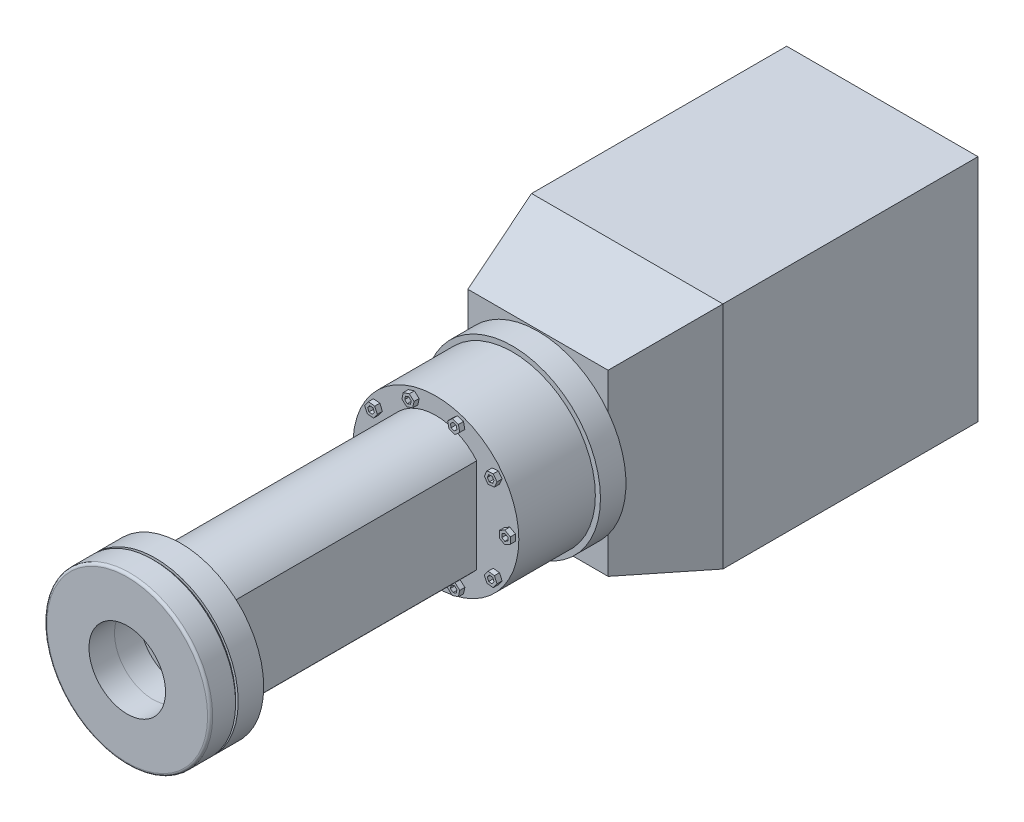
from build123d import *

# Parameters (mm, degrees)
SKETCH1_W           = 75
SKETCH1_H           = 90
BOSS_EXTRUDE1_DEPTH = 100
SKETCH4_R           = 34.5
BOSS_EXTRUDE2_DEPTH = 10
SKETCH5_R           = 32.5
BOSS_EXTRUDE3_DEPTH = 30
BOSS_EXTRUDE4_DEPTH = 2
CIRPATTERN1_COUNT   = 10
BOSS_EXTRUDE5_DEPTH = 100
SKETCH8_R           = 32.5
BOSS_EXTRUDE6_DEPTH = 10
SKETCH9_R           = 31.5
BOSS_EXTRUDE7_DEPTH = 1
SKETCH10_R          = 32.5
BOSS_EXTRUDE8_DEPTH = 10
FILLET2_R           = 1
SKETCH15_R          = 15
CUT_EXTRUDE2_DEPTH  = 20
CUT_EXTRUDE3_START  = -17.5
SKETCH16_R          = 15
CUT_EXTRUDE3_DEPTH  = 20


with BuildPart() as part:
    # Sketch1 → Boss-Extrude1 (new body)
    with BuildSketch(Plane.XY):
        Rectangle(SKETCH1_W, SKETCH1_H)
    extrude(amount=BOSS_EXTRUDE1_DEPTH)

    # Sketch3 → Loft1 section 0
    with BuildSketch(Plane.XY.offset(135)):
        with BuildLine():
            Line((27.5, 35), (-27.5, 35))
            Line((-27.5, 35), (-27.5, -35))
            Line((-27.5, -35), (27.5, -35))
            Line((27.5, -35), (27.5, 35))
        make_face()
    # Sketch2 → Loft1 section 1
    with BuildSketch(Plane.XY.offset(100)):
        with BuildLine():
            Line((37.5, 45), (-37.5, 45))
            Line((-37.5, 45), (-37.5, -45))
            Line((-37.5, -45), (37.5, -45))
            Line((37.5, -45), (37.5, 45))
        make_face()
    loft()

    # Sketch4 → Boss-Extrude2 (add)
    with BuildSketch(Plane.XY.offset(135)):
        with Locations(Location((0, 0, 0), (0, 0, 142.854195828))):
            Circle(SKETCH4_R)
    extrude(amount=BOSS_EXTRUDE2_DEPTH)

    # Sketch5 → Boss-Extrude3 (add)
    with BuildSketch(Plane.XY.offset(145)):
        Circle(SKETCH5_R)
    extrude(amount=BOSS_EXTRUDE3_DEPTH)

    # Sketch6 → Boss-Extrude4 (add)
    with BuildSketch(Plane.XY.offset(175)):
        Polygon((29, 2.5), (26.834936491, 1.25), (26.834936491, -1.25), (29, -2.5), (31.165063509, -1.25), (31.165063509, 1.25), align=None)
        Polygon((29, 1.345299462), (27.834936491, 0.672649731), (27.834936491, -0.672649731), (29, -1.345299462), (30.165063509, -0.672649731), (30.165063509, 0.672649731), align=None, mode=Mode.SUBTRACT)
    boss_extrude4 = extrude(amount=BOSS_EXTRUDE4_DEPTH)

    # CirPattern1: Boss-Extrude4 ×10 about axis
    cirpattern1_axis = Axis((0, 0, 0), (0, 0, 1))
    for i in range(1, CIRPATTERN1_COUNT):
        add(boss_extrude4.rotate(cirpattern1_axis, i * 360 / CIRPATTERN1_COUNT))

    # Sketch7 → Boss-Extrude5 (add)
    with BuildSketch(Plane.XY.offset(175)):
        with BuildLine():
            Line((16, -18.5), (16, 18.5))
            ThreePointArc((16, 18.5), (0, 25.898529491), (-16, 18.5))
            Line((-16, 18.5), (-16, -18.5))
            ThreePointArc((-16, -18.5), (0, -25.898529491), (16, -18.5))
        make_face()
    extrude(amount=BOSS_EXTRUDE5_DEPTH)

    # Sketch8 → Boss-Extrude6 (add)
    with BuildSketch(Plane.XY.offset(275)):
        Circle(SKETCH8_R)
    extrude(amount=BOSS_EXTRUDE6_DEPTH)

    # Sketch9 → Boss-Extrude7 (add)
    with BuildSketch(Plane.XY.offset(285)):
        Circle(SKETCH9_R)
    extrude(amount=BOSS_EXTRUDE7_DEPTH)


with BuildPart() as body_2:
    # Sketch10 → Boss-Extrude8 (new body)
    with BuildSketch(Plane.XY.offset(286)):
        Circle(SKETCH10_R)
    extrude(amount=BOSS_EXTRUDE8_DEPTH)

    # Fillet2
    fillet2_edges = [body_2.edges().sort_by_distance(p)[0] for p in [
        (-32.5, 0, 296),
    ]]
    fillet(fillet2_edges, radius=FILLET2_R)


with BuildPart() as cut_extrude2_tool:
    # Sketch15 → Cut-Extrude2 (new body)
    with BuildSketch(Plane.XY.offset(296)):
        Circle(SKETCH15_R)
    extrude(amount=-CUT_EXTRUDE2_DEPTH)


with BuildPart() as part_1:
    add(part.part)

    # Cut-Extrude2: cut by cut_extrude2_tool
    add(cut_extrude2_tool.part, mode=Mode.SUBTRACT)

    # Sketch16 → Cut-Extrude3 (cut)
    with BuildSketch(Plane(origin=(0, 0, 0), x_dir=(0, 0, -1), z_dir=(1, 0, 0)).offset(CUT_EXTRUDE3_START)):
        with Locations((-36.991386067, 0)):
            Circle(SKETCH16_R)
    extrude(amount=-CUT_EXTRUDE3_DEPTH, mode=Mode.SUBTRACT)


with BuildPart() as body_2_1:
    add(body_2.part)

    # Cut-Extrude2: cut by cut_extrude2_tool
    add(cut_extrude2_tool.part, mode=Mode.SUBTRACT)


solid = Compound([part_1.part, body_2_1.part])
